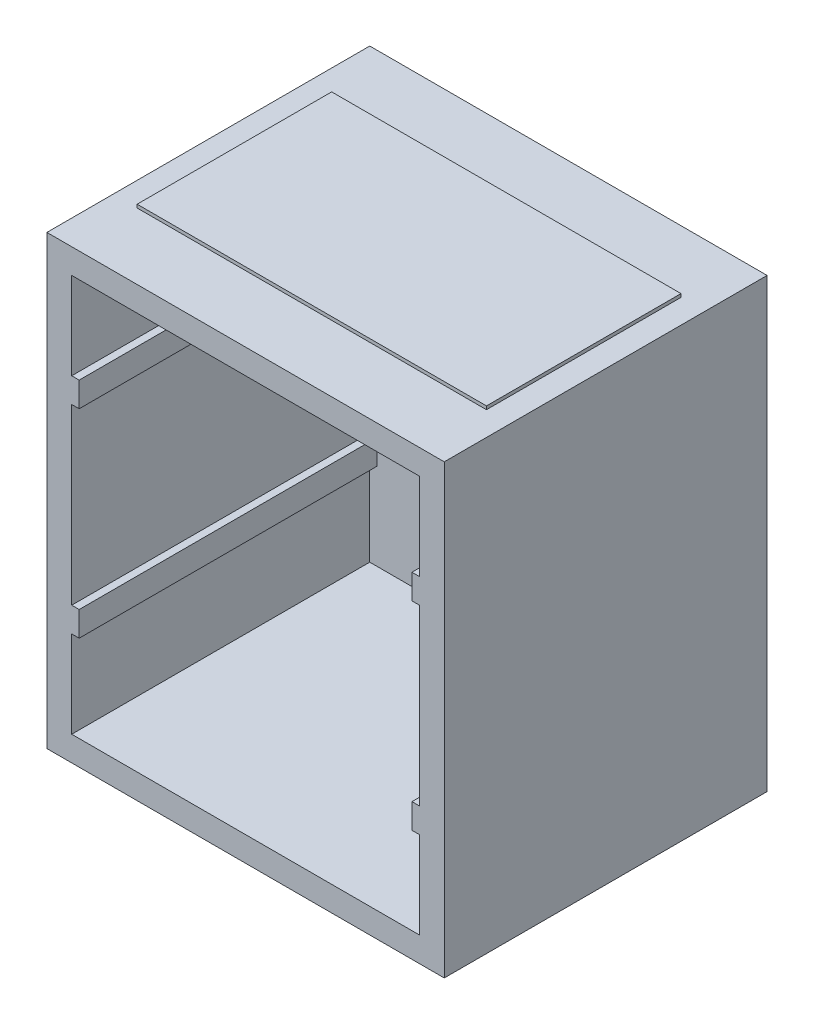
from build123d import *

# Parameters (mm, degrees)
SKETCH1_W           = 406.4
SKETCH1_H           = 457.2
BOSS_EXTRUDE1_DEPTH = 330.2
SHELL1_T            = -25.4
SKETCH2_W           = 304.8
SKETCH2_H           = 25.4
BOSS_EXTRUDE2_DEPTH = 7.62
SCALE1_SCALE        = 0.75
SKETCH3_W           = 267.97
SKETCH3_H           = 149.225
BOSS_EXTRUDE3_DEPTH = 2.54


with BuildPart() as part:
    # Sketch1 → Boss-Extrude1 (new body)
    with BuildSketch(Plane.XY):
        Rectangle(SKETCH1_W, SKETCH1_H)
    extrude(amount=-BOSS_EXTRUDE1_DEPTH)

    # Shell1
    shell1_openings = [part.faces().sort_by_distance(p)[0] for p in [
        (0, 0, 0),
    ]]
    offset(amount=SHELL1_T, openings=shell1_openings, kind=Kind.INTERSECTION)

    # Sketch2 → Boss-Extrude2 (add)
    with BuildSketch(Plane(origin=(-177.8, 0, 0), x_dir=(0, 0, -1), z_dir=(1, 0, 0))):
        with Locations((152.4, -101.6)):
            Rectangle(SKETCH2_W, SKETCH2_H)
        with Locations((152.4, 101.6)):
            Rectangle(SKETCH2_W, SKETCH2_H)
    boss_extrude2 = extrude(amount=BOSS_EXTRUDE2_DEPTH)

    # Mirror1: Boss-Extrude2 across plane
    add(boss_extrude2.mirror(Plane(origin=(0, 0, 0), x_dir=(0, 0, 1), z_dir=(1, 0, 0))))


with BuildPart() as part_1:
    # Scale1: scaled about (0, 0, -196.821524664)
    add(part.part.scale(SCALE1_SCALE).moved(Location((0, 0, -49.205381166))))

    # Sketch3 → Boss-Extrude3 (add)
    with BuildSketch(Plane(origin=(0, 171.45, 0), x_dir=(1, 0, 0), z_dir=(0, 1, 0))):
        with Locations((0, 174.617881166)):
            Rectangle(SKETCH3_W, SKETCH3_H)
    extrude(amount=BOSS_EXTRUDE3_DEPTH)


solid = part_1.part
